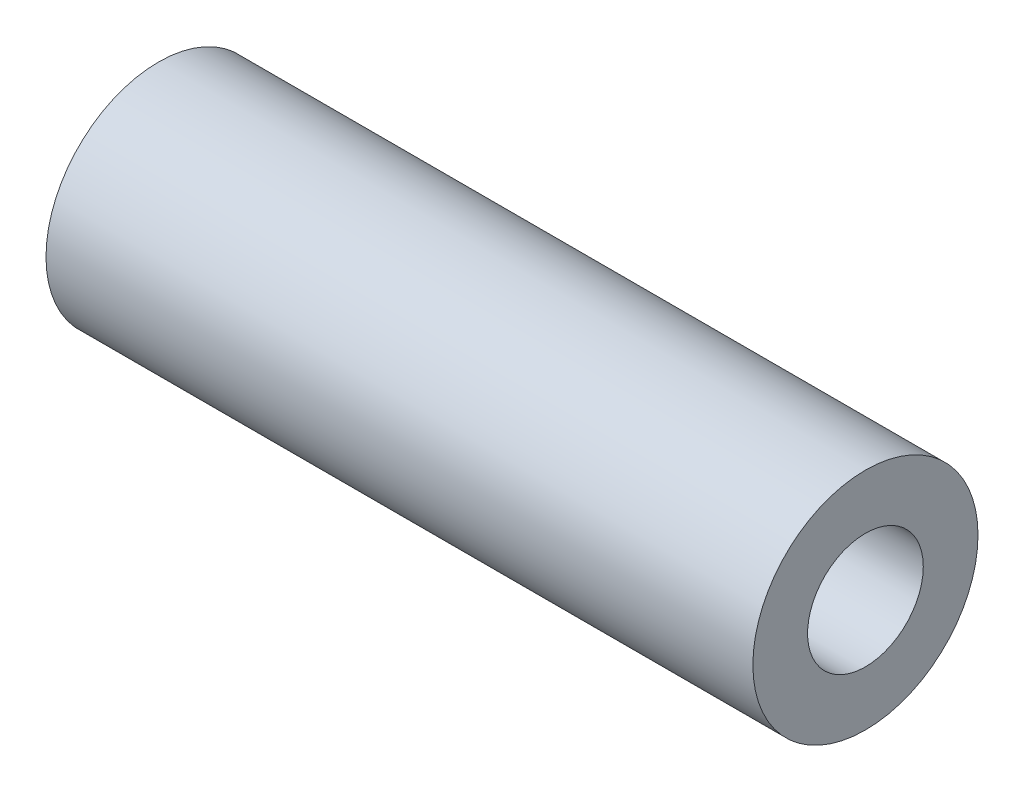
from build123d import *

# Parameters (mm, degrees)
SKETCH1_R           = 6.35
SKETCH1_R_2         = 3.2639
BOSS_EXTRUDE1_DEPTH = 39.878


with BuildPart() as part:
    # Sketch1 → Boss-Extrude1 (new body)
    with BuildSketch(Plane(origin=(0, 0, 0), x_dir=(0, 0, -1), z_dir=(1, 0, 0))):
        Circle(SKETCH1_R)
        Circle(SKETCH1_R_2, mode=Mode.SUBTRACT)
    extrude(amount=BOSS_EXTRUDE1_DEPTH)


solid = part.part
